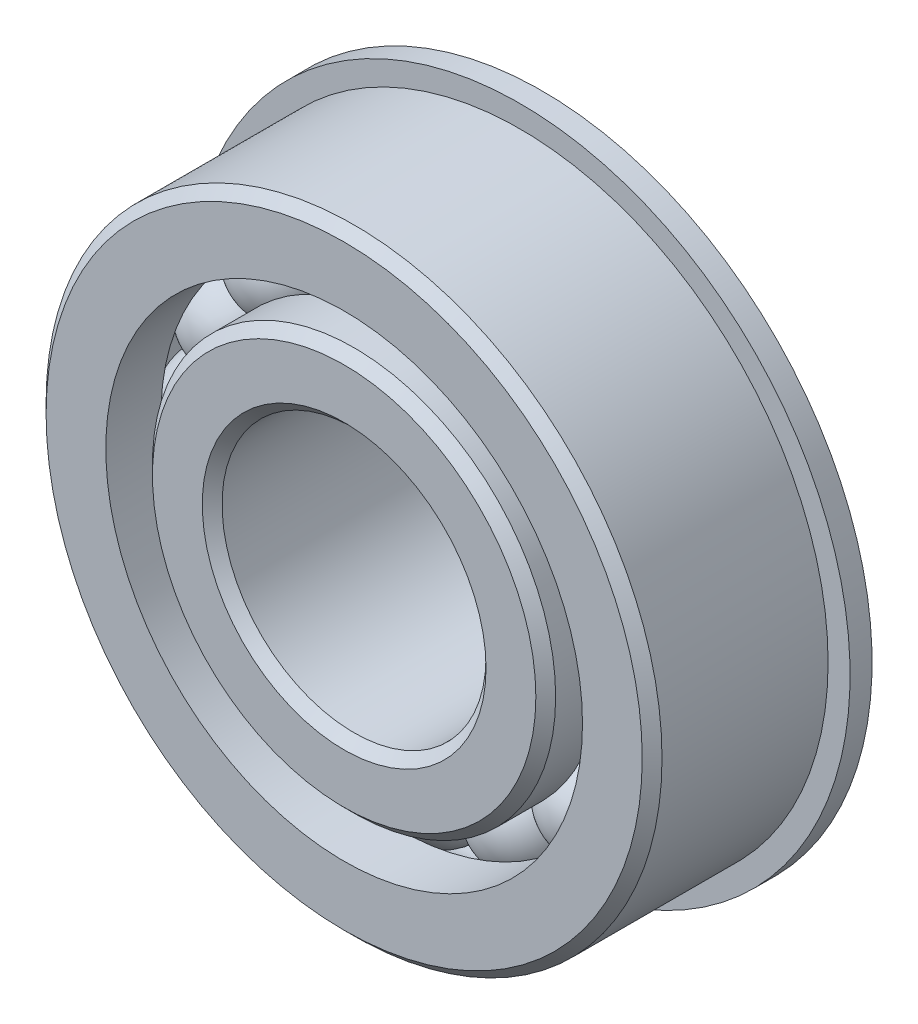
from build123d import *

# Parameters (mm, degrees)
CIRPATTERN1_COUNT = 16
SKETCH6_W         = 1.5875
SKETCH6_H         = 6.611675824


with BuildPart() as part:
    # Sketch1 → Revolve1 (revolve)
    with BuildSketch(Plane(origin=(0, 0, 0), x_dir=(0, 0, -1), z_dir=(1, 0, 0))):
        with BuildLine():
            Line((6.429375, 22.225), (-6.429375, 22.225))
            Line((-6.429375, 22.225), (-7.14375, 21.510625))
            Line((-7.14375, 21.510625), (-7.14375, 17.200824176))
            Line((-7.14375, 17.200824176), (-3.175, 17.200824176))
            ThreePointArc((-3.175, 17.200824176), (0, 19.315702653), (3.175, 17.200824176))
            Line((3.175, 17.200824176), (7.14375, 17.200824176))
            Line((7.14375, 17.200824176), (7.14375, 21.510625))
            Line((7.14375, 21.510625), (6.429375, 22.225))
        make_face()
    revolve(axis=Axis((0, 0, 7.14375), (0, 0, -1)))

    # Sketch6 → Revolve6 (revolve)
    with BuildSketch(Plane(origin=(0, 0, 0), x_dir=(0, 0, -1), z_dir=(1, 0, 0))):
        with Locations((6.35, 20.506662088)):
            Rectangle(SKETCH6_W, SKETCH6_H)
    revolve(axis=Axis((0, 0, -7.14375), (0, 0, 1)))


with BuildPart() as body_2:
    # Sketch3 → Revolve3 (revolve)
    with BuildSketch(Plane(origin=(0, 0, 0), x_dir=(0, 0, -1), z_dir=(1, 0, 0))):
        with BuildLine():
            Line((-7.14375, 10.239375), (-7.14375, 13.834800824))
            Line((-7.14375, 13.834800824), (-6.429375, 14.549175824))
            Line((-6.429375, 14.549175824), (-3.175, 14.549175824))
            ThreePointArc((-3.175, 14.549175824), (0, 12.434297347), (3.175, 14.549175824))
            Line((3.175, 14.549175824), (8.016875, 14.549175824))
            Line((8.016875, 14.549175824), (8.73125, 13.834800824))
            Line((8.73125, 13.834800824), (8.73125, 10.239375))
            Line((8.73125, 10.239375), (8.016875, 9.525))
            Line((8.016875, 9.525), (-6.429375, 9.525))
            Line((-6.429375, 9.525), (-7.14375, 10.239375))
        make_face()
    revolve(axis=Axis((0, 0, 7.14375), (0, 0, -1)))


with BuildPart() as body_3:
    # Sketch4 → Revolve4 (revolve)
    with BuildSketch(Plane(origin=(0, 0, 0), x_dir=(0, 0, -1), z_dir=(1, 0, 0))):
        with BuildLine():
            Line((-3.440702653, 15.875), (3.440702653, 15.875))
            ThreePointArc((3.440702653, 15.875), (0, 19.315702653), (-3.440702653, 15.875))
        make_face()
    revolve(axis=Axis((0, 15.875, 3.440702653), (0, 0, -1)))


with BuildPart() as cirpattern1_1:
    # CirPattern1: pattern copy
    add(body_3.part.rotate(Axis((0, 0, -7.14375), (0, 0, 1)), 1 * 360 / CIRPATTERN1_COUNT))


with BuildPart() as cirpattern1_2:
    # CirPattern1: pattern copy
    add(body_3.part.rotate(Axis((0, 0, -7.14375), (0, 0, 1)), 2 * 360 / CIRPATTERN1_COUNT))


with BuildPart() as cirpattern1_3:
    # CirPattern1: pattern copy
    add(body_3.part.rotate(Axis((0, 0, -7.14375), (0, 0, 1)), 3 * 360 / CIRPATTERN1_COUNT))


with BuildPart() as cirpattern1_4:
    # CirPattern1: pattern copy
    add(body_3.part.rotate(Axis((0, 0, -7.14375), (0, 0, 1)), 4 * 360 / CIRPATTERN1_COUNT))


with BuildPart() as cirpattern1_5:
    # CirPattern1: pattern copy
    add(body_3.part.rotate(Axis((0, 0, -7.14375), (0, 0, 1)), 5 * 360 / CIRPATTERN1_COUNT))


with BuildPart() as cirpattern1_6:
    # CirPattern1: pattern copy
    add(body_3.part.rotate(Axis((0, 0, -7.14375), (0, 0, 1)), 6 * 360 / CIRPATTERN1_COUNT))


with BuildPart() as cirpattern1_7:
    # CirPattern1: pattern copy
    add(body_3.part.rotate(Axis((0, 0, -7.14375), (0, 0, 1)), 7 * 360 / CIRPATTERN1_COUNT))


with BuildPart() as cirpattern1_8:
    # CirPattern1: pattern copy
    add(body_3.part.rotate(Axis((0, 0, -7.14375), (0, 0, 1)), 8 * 360 / CIRPATTERN1_COUNT))


with BuildPart() as cirpattern1_9:
    # CirPattern1: pattern copy
    add(body_3.part.rotate(Axis((0, 0, -7.14375), (0, 0, 1)), 9 * 360 / CIRPATTERN1_COUNT))


with BuildPart() as cirpattern1_10:
    # CirPattern1: pattern copy
    add(body_3.part.rotate(Axis((0, 0, -7.14375), (0, 0, 1)), 10 * 360 / CIRPATTERN1_COUNT))


with BuildPart() as cirpattern1_11:
    # CirPattern1: pattern copy
    add(body_3.part.rotate(Axis((0, 0, -7.14375), (0, 0, 1)), 11 * 360 / CIRPATTERN1_COUNT))


with BuildPart() as cirpattern1_12:
    # CirPattern1: pattern copy
    add(body_3.part.rotate(Axis((0, 0, -7.14375), (0, 0, 1)), 12 * 360 / CIRPATTERN1_COUNT))


with BuildPart() as cirpattern1_13:
    # CirPattern1: pattern copy
    add(body_3.part.rotate(Axis((0, 0, -7.14375), (0, 0, 1)), 13 * 360 / CIRPATTERN1_COUNT))


with BuildPart() as cirpattern1_14:
    # CirPattern1: pattern copy
    add(body_3.part.rotate(Axis((0, 0, -7.14375), (0, 0, 1)), 14 * 360 / CIRPATTERN1_COUNT))


with BuildPart() as cirpattern1_15:
    # CirPattern1: pattern copy
    add(body_3.part.rotate(Axis((0, 0, -7.14375), (0, 0, 1)), 15 * 360 / CIRPATTERN1_COUNT))


solid = Compound([part.part, body_2.part, body_3.part, cirpattern1_1.part, cirpattern1_2.part, cirpattern1_3.part, cirpattern1_4.part, cirpattern1_5.part, cirpattern1_6.part, cirpattern1_7.part, cirpattern1_8.part, cirpattern1_9.part, cirpattern1_10.part, cirpattern1_11.part, cirpattern1_12.part, cirpattern1_13.part, cirpattern1_14.part, cirpattern1_15.part])
